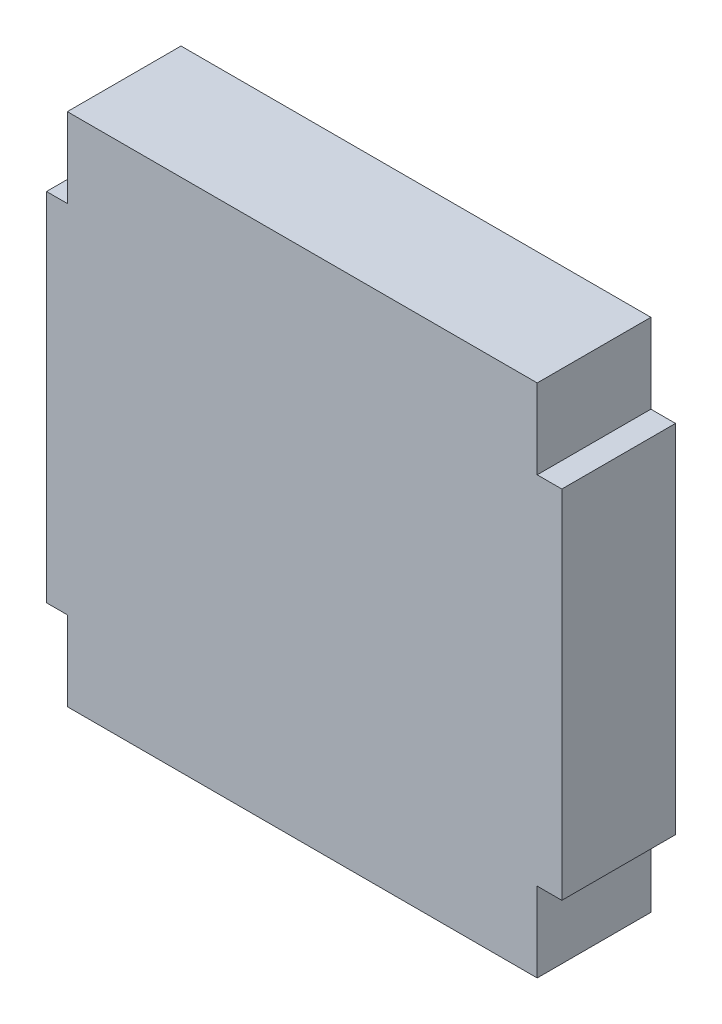
from build123d import *

# Parameters (mm, degrees)
COMPONENT_OUTLINE_DEPTH = 1.5


with BuildPart() as part:
    # 草图1 → Component_Outline (new body)
    with BuildSketch(Plane.XY):
        Polygon((3.1, 3.4), (3.1, 2.35), (3.425, 2.35), (3.425, -2.35), (3.1, -2.35), (3.1, -3.4), (-3.1, -3.4), (-3.1, -2.35), (-3.375, -2.35), (-3.375, 2.35), (-3.1, 2.35), (-3.1, 3.4), align=None)
    extrude(amount=COMPONENT_OUTLINE_DEPTH)


solid = part.part
